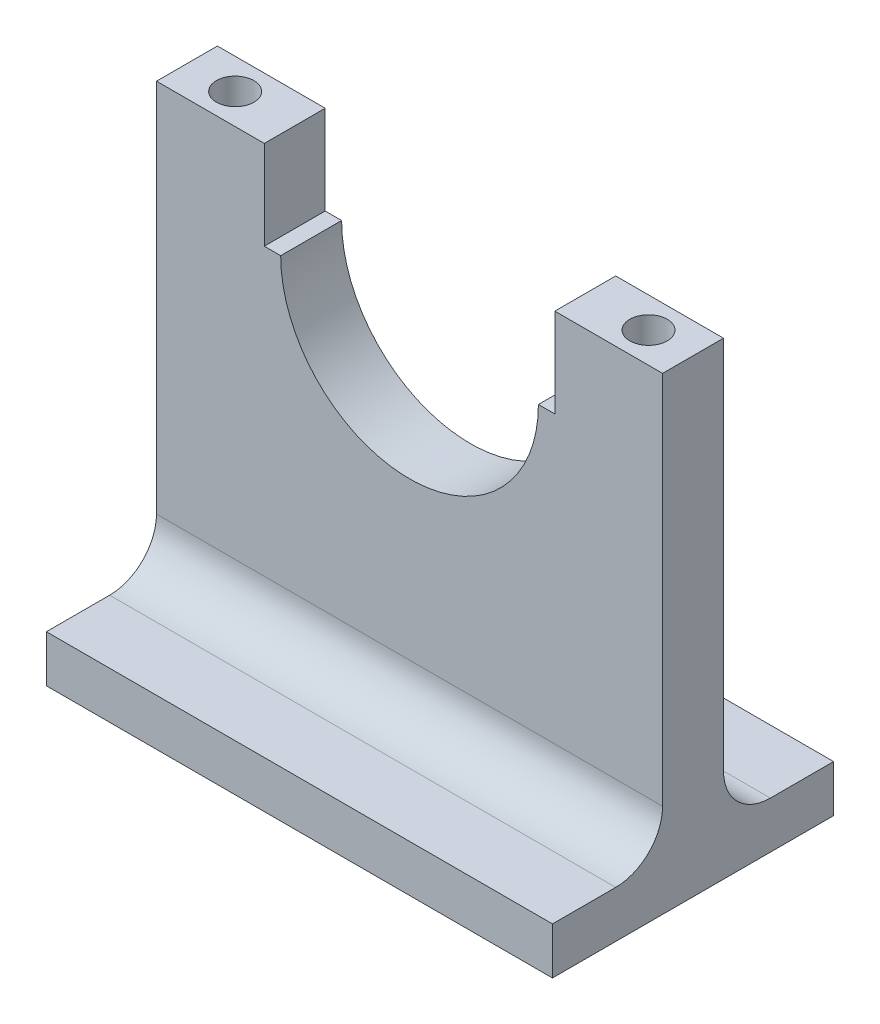
from build123d import *

# Parameters (mm, degrees)
SKETCH1_W           = 108
SKETCH1_H           = 10
BOSS_EXTRUDE1_DEPTH = 30
BOSS_EXTRUDE2_DEPTH = 6.5
SKETCH3_R           = 4
CUT_EXTRUDE1_DEPTH  = 22
FILLET1_R           = 10


with BuildPart() as part:
    # Sketch1 → Boss-Extrude1 (new, symmetric)
    with BuildSketch(Plane.XY):
        Rectangle(SKETCH1_W, SKETCH1_H)
    extrude(amount=BOSS_EXTRUDE1_DEPTH, both=True)

    # Sketch2 → Boss-Extrude2 (add, symmetric)
    with BuildSketch(Plane.XY):
        with BuildLine():
            Line((-54, 5), (-54, 95))
            Line((-54, 95), (-31, 95))
            Line((-31, 95), (-31, 76))
            Line((-31, 76), (-27.5, 76))
            ThreePointArc((-27.5, 76), (0, 48.5), (27.5, 76))
            Line((27.5, 76), (31, 76))
            Line((31, 76), (31, 95))
            Line((31, 95), (54, 95))
            Line((54, 95), (54, 5))
            Line((54, 5), (-54, 5))
        make_face()
    extrude(amount=BOSS_EXTRUDE2_DEPTH, both=True)

    # Sketch3 → Cut-Extrude1 (cut)
    with BuildSketch(Plane(origin=(0, 95, 0), x_dir=(1, 0, 0), z_dir=(0, 1, 0))):
        with Locations(Location((44.5, 0, 0), (0, 0, 180))):
            Circle(SKETCH3_R)
        with Locations((-43.715454096, 0)):
            Circle(SKETCH3_R)
    extrude(amount=-CUT_EXTRUDE1_DEPTH, mode=Mode.SUBTRACT)

    # Fillet1
    fillet1_edges = [part.edges().sort_by_distance(p)[0] for p in [
        (0, 5, -6.5),
        (0, 5, 6.5),
    ]]
    fillet(fillet1_edges, radius=FILLET1_R)


solid = part.part
